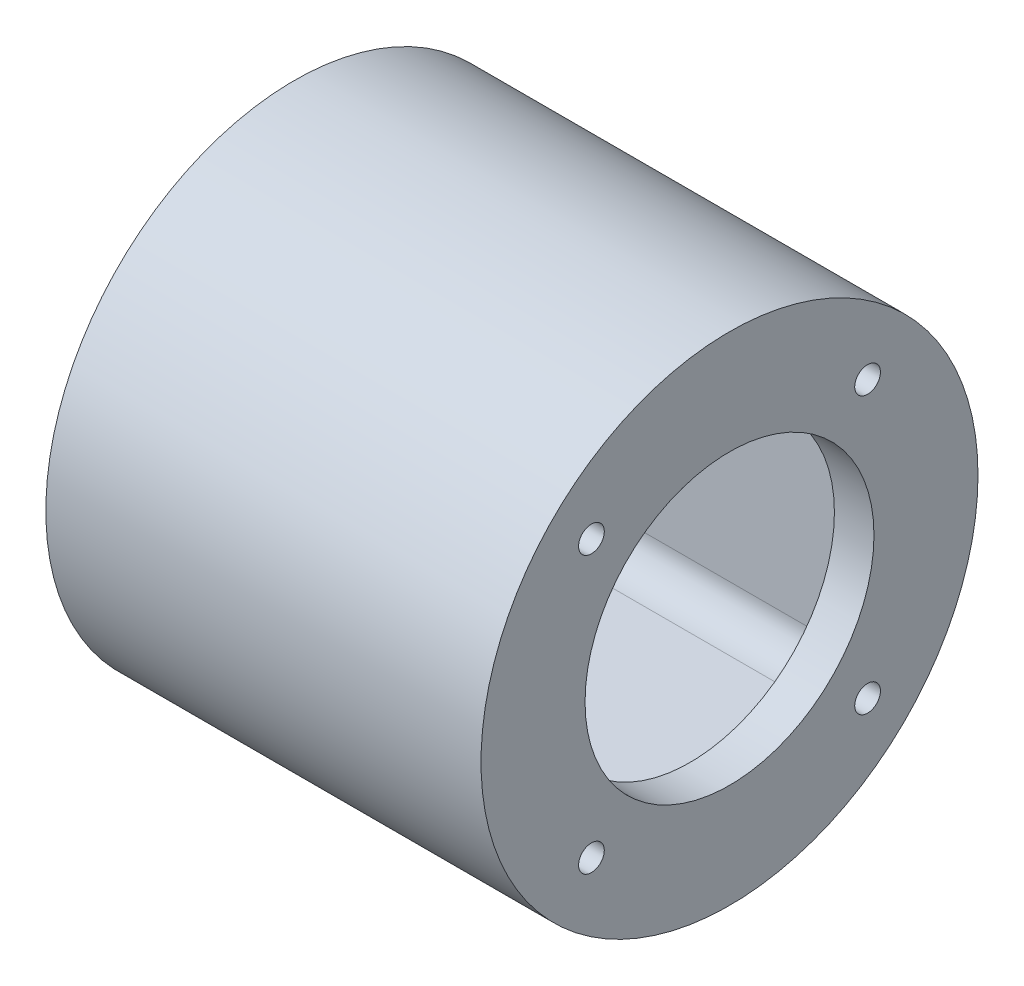
from build123d import *

# Parameters (mm, degrees)
SKETCH1_R           = 62.811183182
SKETCH1_R_2         = 3.25
SKETCH1_R_3         = 36.5175
BOSS_EXTRUDE1_DEPTH = 10
BOSS_EXTRUDE2_START = -100
SKETCH1_3_R         = 62.811183182
BOSS_EXTRUDE2_DEPTH = 100


with BuildPart() as part:
    # Sketch1 → Boss-Extrude1 (new body)
    with BuildSketch(Plane(origin=(0, 0, 0), x_dir=(0, 0, -1), z_dir=(1, 0, 0))):
        Circle(SKETCH1_R)
        with Locations((-34.9, -34.9)):
            Circle(SKETCH1_R_2, mode=Mode.SUBTRACT)
        with Locations((34.9, -34.9)):
            Circle(SKETCH1_R_2, mode=Mode.SUBTRACT)
        with Locations((-34.9, 34.9)):
            Circle(SKETCH1_R_2, mode=Mode.SUBTRACT)
        Circle(SKETCH1_R_3, mode=Mode.SUBTRACT)
        with Locations((34.9, 34.9)):
            Circle(SKETCH1_R_2, mode=Mode.SUBTRACT)
    extrude(amount=BOSS_EXTRUDE1_DEPTH)

    # Sketch1<3> → Boss-Extrude2 (add)
    with BuildSketch(Plane(origin=(0, 0, 0), x_dir=(0, 0, -1), z_dir=(1, 0, 0)).offset(BOSS_EXTRUDE2_START)):
        Circle(SKETCH1_3_R)
        with BuildLine():
            ThreePointArc((43, -34.9), (40.627564928, -40.627564928), (34.9, -43))
            Line((34.9, -43), (-34.9, -43))
            ThreePointArc((-34.9, -43), (-40.627564928, -40.627564928), (-43, -34.9))
            Line((-43, -34.9), (-43, 34.9))
            ThreePointArc((-43, 34.9), (-40.627564928, 40.627564928), (-34.9, 43))
            Line((-34.9, 43), (34.9, 43))
            ThreePointArc((34.9, 43), (40.627564928, 40.627564928), (43, 34.9))
            Line((43, 34.9), (43, -34.9))
        make_face(mode=Mode.SUBTRACT)
    extrude(amount=BOSS_EXTRUDE2_DEPTH)


solid = part.part
